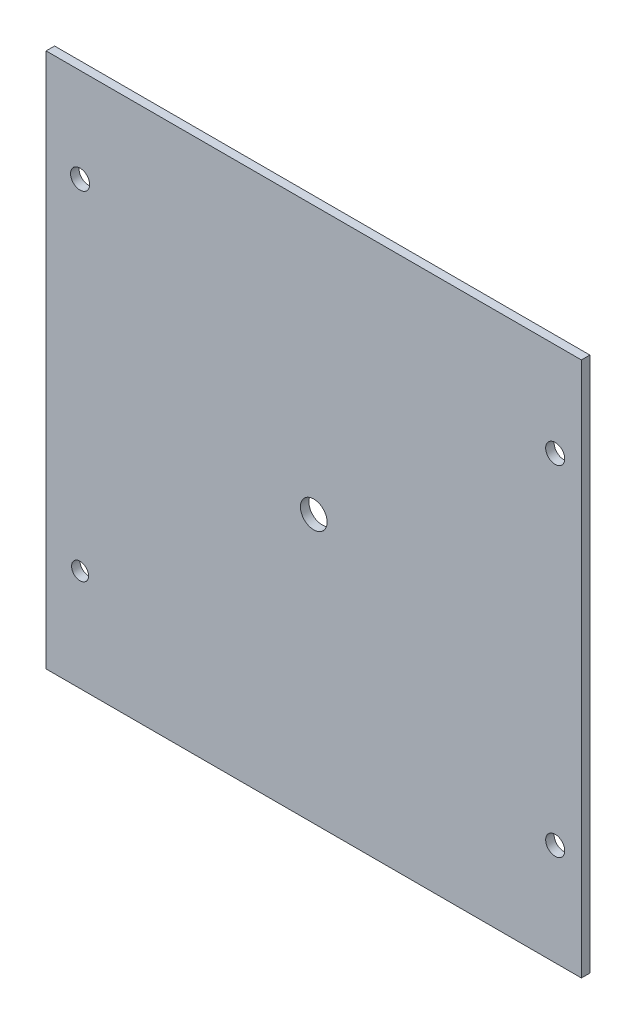
from build123d import *

# Parameters (mm, degrees)
SKETCH1_W           = 200.3
SKETCH1_H           = 200.3
SKETCH1_R           = 3.175
SKETCH1_R_2         = 3.57
SKETCH1_R_3         = 5
BOSS_EXTRUDE1_DEPTH = 3.175


with BuildPart() as part:
    # Sketch1 → Boss-Extrude1 (new body)
    with BuildSketch(Plane.XY):
        with Locations((100.15, 100.15)):
            Rectangle(SKETCH1_W, SKETCH1_H)
        with Locations((12.7, 38.1)):
            Circle(SKETCH1_R, mode=Mode.SUBTRACT)
        with Locations((12.7, 165.1)):
            Circle(SKETCH1_R_2, mode=Mode.SUBTRACT)
        with Locations((190.5, 165.1)):
            Circle(SKETCH1_R_2, mode=Mode.SUBTRACT)
        with Locations((190.5, 38.1)):
            Circle(SKETCH1_R_2, mode=Mode.SUBTRACT)
        with Locations((100.15, 100.15)):
            Circle(SKETCH1_R_3, mode=Mode.SUBTRACT)
    extrude(amount=BOSS_EXTRUDE1_DEPTH)


solid = part.part
